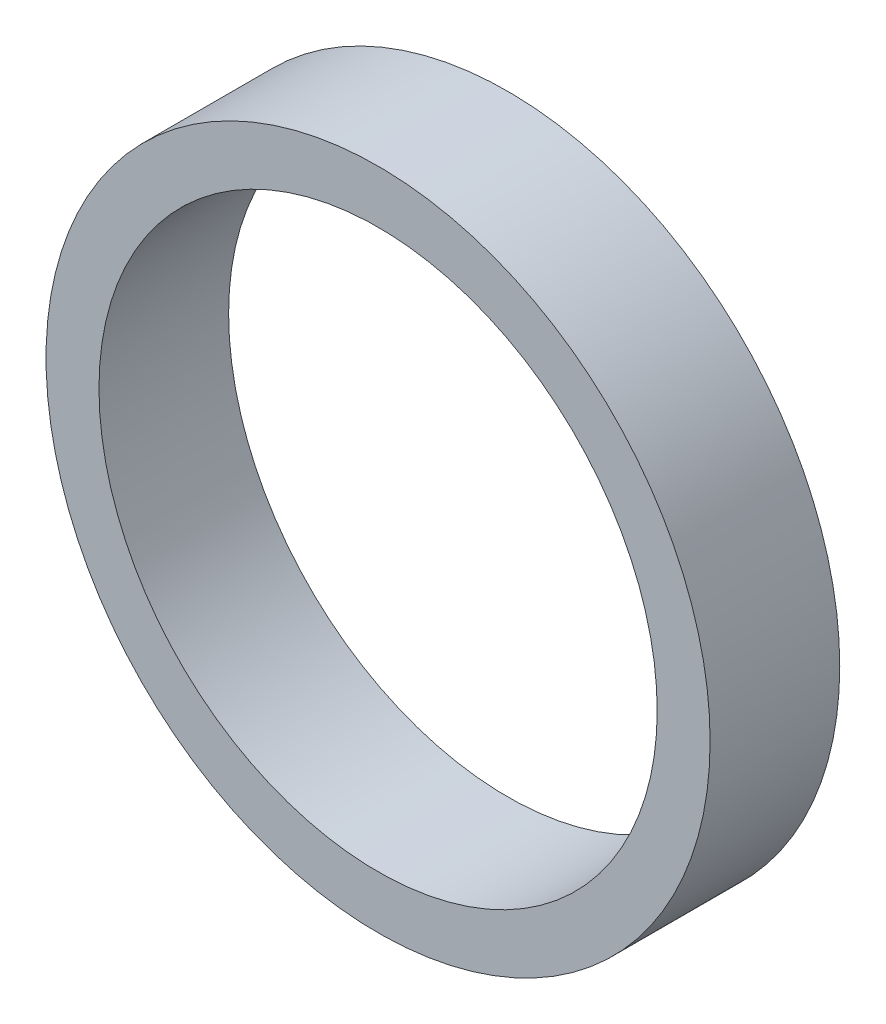
from build123d import *

# Parameters (mm, degrees)
SKETCH_1_R      = 12.55
SKETCH_1_R_2    = 10.55
EXTRUDE_1_DEPTH = 4.9


with BuildPart() as part:
    # 草图1 → 拉伸-薄壁1 (new body)
    with BuildSketch(Plane.XY):
        Circle(SKETCH_1_R)
        Circle(SKETCH_1_R_2, mode=Mode.SUBTRACT)
    extrude(amount=EXTRUDE_1_DEPTH)


solid = part.part
